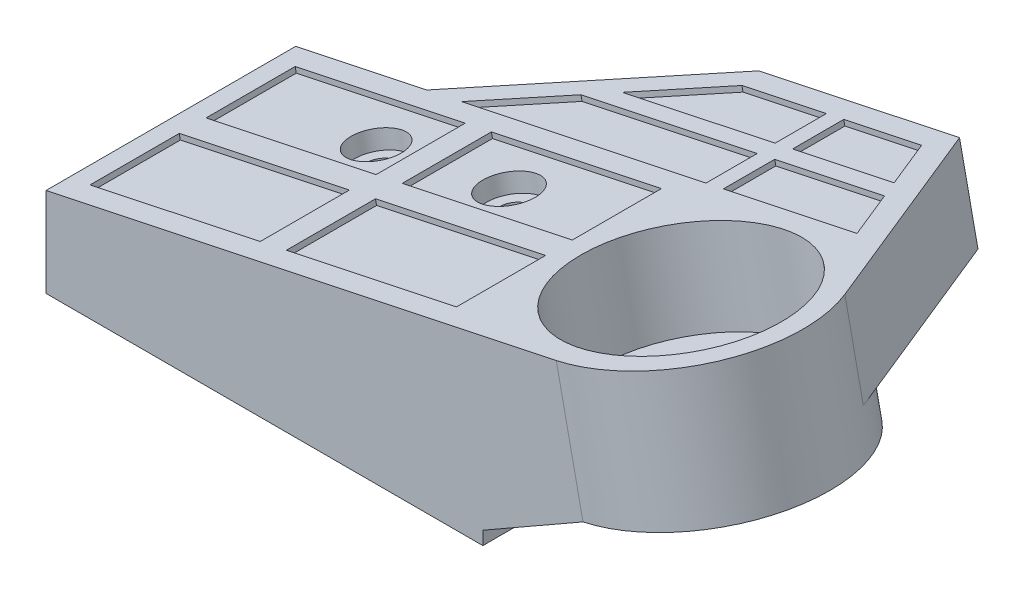
from build123d import *

# Parameters (mm, degrees)
SALIENTE_EXTRUIR1_DEPTH = 14
SALIENTE_EXTRUIR2_DEPTH = 14.497
SALIENTE_EXTRUIR3_DEPTH = 14
SALIENTE_EXTRUIR4_DEPTH = 16
CORTAR_EXTRUIR1_DEPTH   = 16
CORTAR_EXTRUIR3_DEPTH   = 16
SALIENTE_EXTRUIR5_DEPTH = 10
CROQUIS10_R             = 11.5
CORTAR_EXTRUIR4_DEPTH   = 10
CROQUIS11_R             = 1.5
CORTAR_EXTRUIR5_DEPTH   = 10
CROQUIS12_W             = 19.5
CROQUIS12_H             = 10
CORTAR_EXTRUIR6_DEPTH   = 0.6
CROQUIS13_R             = 3.0005
CORTAR_EXTRUIR7_DEPTH   = 2
CROQUIS14_R             = 1.5
CORTAR_EXTRUIR8_DEPTH   = 84.1308046
CROQUIS15_R             = 2.879821228
CORTAR_EXTRUIR9_DEPTH   = 2
CROQUIS16_R             = 1.5
CORTAR_EXTRUIR10_DEPTH  = 84.1308046


with BuildPart() as part:
    # Croquis1 → Saliente-Extruir1 (new, symmetric)
    with BuildSketch(Plane.XY):
        Polygon((0, 10), (0, 0), (49, 0), (49, 20.362545892), align=None)
    extrude(amount=SALIENTE_EXTRUIR1_DEPTH, both=True)

    # Croquis3 → Saliente-Extruir2 (add)
    with BuildSketch(Plane(origin=(-2.024271727, 9.571905945, 0), x_dir=(0.9783611779651771, 0.20690433888778445, 0), z_dir=(-0.20690433888778445, 0.9783611779651771, 0))):
        with BuildLine():
            Line((44.319015144, -14), (60.569043389, -14))
            ThreePointArc((60.569043389, -14), (74.569043389, 0), (60.569043389, 14))
            Line((60.569043389, 14), (44.319015144, 14))
            Line((44.319015144, 14), (44.319015144, -14))
        make_face()
    extrude(amount=-SALIENTE_EXTRUIR2_DEPTH)

    # Croquis5 → Saliente-Extruir3 (add, symmetric)
    with BuildSketch(Plane.XY):
        Polygon((49, 6.954034303), (49, 1.5), (60.233736519, 7.920349276), align=None)
    extrude(amount=SALIENTE_EXTRUIR3_DEPTH, both=True)

    # Croquis6 → Saliente-Extruir4 (add)
    with BuildSketch(Plane(origin=(0, 0, -14), x_dir=(-1, 0, 0), z_dir=(0, 0, -1))):
        Polygon((-14.691071448, 13.106875553), (-16.760114837, 3.323263773), (-67.96558217, 14.152223062), (-65.896538781, 23.935834841), align=None)
    extrude(amount=SALIENTE_EXTRUIR4_DEPTH)

    # Croquis7 → Cortar-Extruir1 (cut)
    with BuildSketch(Plane(origin=(-2.024271727, 9.571905945, 0), x_dir=(0.9783611779651771, 0.20690433888778445, 0), z_dir=(-0.20690433888778445, 0.9783611779651771, 0))):
        Polygon((17.085043389, 14), (38.83360656, 30), (17.085043389, 30), align=None)
    extrude(amount=-CORTAR_EXTRUIR1_DEPTH, mode=Mode.SUBTRACT)

    # Croquis8 → Cortar-Extruir3 (cut)
    with BuildSketch(Plane(origin=(-2.024271727, 9.571905945, 0), x_dir=(0.9783611779651771, 0.20690433888778445, 0), z_dir=(-0.20690433888778445, 0.9783611779651771, 0))):
        Polygon((61.83360656, 30), (73.218033408, 6.000254286), (73.218033408, 30), align=None)
    extrude(amount=-CORTAR_EXTRUIR3_DEPTH, mode=Mode.SUBTRACT)

    # Croquis9 → Saliente-Extruir5 (add)
    with BuildSketch(Plane(origin=(-2.024271727, 9.571905945, 0), x_dir=(0.9783611779651771, 0.20690433888778445, 0), z_dir=(-0.20690433888778445, 0.9783611779651771, 0))):
        Polygon((61.83360656, 30), (73.218033408, 6.000254286), (49.824419891, 6.000254286), align=None)
    extrude(amount=-SALIENTE_EXTRUIR5_DEPTH)

    # Croquis10 → Cortar-Extruir4 (cut)
    with BuildSketch(Plane(origin=(-2.024271727, 9.571905945, 0), x_dir=(0.9783611779651771, 0.20690433888778445, 0), z_dir=(-0.20690433888778445, 0.9783611779651771, 0))):
        with Locations((60.569043389, 0)):
            Circle(CROQUIS10_R)
    extrude(amount=-CORTAR_EXTRUIR4_DEPTH, mode=Mode.SUBTRACT)

    # Croquis11 → Cortar-Extruir5 (cut)
    with BuildSketch(Plane(origin=(0.044771662, -0.211705834, 0), x_dir=(0.9783611779651771, 0.20690433888778445, 0), z_dir=(-0.20690433888778445, 0.9783611779651771, 0))):
        with Locations((60.569043389, 0)):
            Circle(CROQUIS11_R)
    extrude(amount=-CORTAR_EXTRUIR5_DEPTH, mode=Mode.SUBTRACT)

    # Croquis12 → Cortar-Extruir6 (cut)
    with BuildSketch(Plane(origin=(-2.024271727, 9.571905945, 0), x_dir=(0.9783611779651771, 0.20690433888778445, 0), z_dir=(-0.20690433888778445, 0.9783611779651771, 0))):
        with Locations((14.319043389, -6.5)):
            Rectangle(CROQUIS12_W, CROQUIS12_H)
        with Locations((36.819043389, 6.5)):
            Rectangle(CROQUIS12_W, CROQUIS12_H)
        with Locations((36.819043389, -6.5)):
            Rectangle(CROQUIS12_W, CROQUIS12_H)
        with Locations((14.319043389, 6.5)):
            Rectangle(CROQUIS12_W, CROQUIS12_H)
        Polygon((51.115043389, 19.75), (51.115043389, 14), (66.438043389, 14), (63.710043389, 19.75), align=None)
        Polygon((21.085043389, 14), (49.115043389, 14), (49.115043389, 19.75), (28.901043389, 19.75), align=None)
        Polygon((31.620043389, 21.75), (49.115043389, 21.75), (49.115043389, 27.5), (39.436043389, 27.5), align=None)
        Polygon((51.115043389, 27.5), (51.115043389, 21.75), (62.761043389, 21.75), (60.034043389, 27.5), align=None)
    extrude(amount=-CORTAR_EXTRUIR6_DEPTH, mode=Mode.SUBTRACT)

    # Croquis13 → Cortar-Extruir7 (cut)
    with BuildSketch(Plane(origin=(-1.900129124, 8.984889239, 0), x_dir=(0.9783611779651771, 0.20690433888778448, 0), z_dir=(-0.20690433888778448, 0.9783611779651771, 0))):
        with Locations((34.584043389, 6)):
            Circle(CROQUIS13_R)
    extrude(amount=-CORTAR_EXTRUIR7_DEPTH, mode=Mode.SUBTRACT)

    # Croquis14 → Cortar-Extruir8 (cut, through all)
    with BuildSketch(Plane(origin=(-1.486320446, 7.028166883, 0), x_dir=(0.9783611779651771, 0.20690433888778448, 0), z_dir=(-0.20690433888778448, 0.9783611779651771, 0))):
        with Locations((34.584043389, 6)):
            Circle(CROQUIS14_R)
    extrude(amount=-CORTAR_EXTRUIR8_DEPTH, mode=Mode.SUBTRACT)

    # Croquis15 → Cortar-Extruir9 (cut)
    with BuildSketch(Plane(origin=(-1.900129124, 8.984889239, 0), x_dir=(0.9783611779651771, 0.20690433888778448, 0), z_dir=(-0.20690433888778448, 0.9783611779651771, 0))):
        with Locations((19.384043389, 5.967)):
            Circle(CROQUIS15_R)
    extrude(amount=-CORTAR_EXTRUIR9_DEPTH, mode=Mode.SUBTRACT)

    # Croquis16 → Cortar-Extruir10 (cut, through all)
    with BuildSketch(Plane(origin=(-1.486320446, 7.028166883, 0), x_dir=(0.9783611779651771, 0.20690433888778448, 0), z_dir=(-0.20690433888778448, 0.9783611779651771, 0))):
        with Locations((19.384043389, 5.967)):
            Circle(CROQUIS16_R)
    extrude(amount=-CORTAR_EXTRUIR10_DEPTH, mode=Mode.SUBTRACT)


solid = part.part
